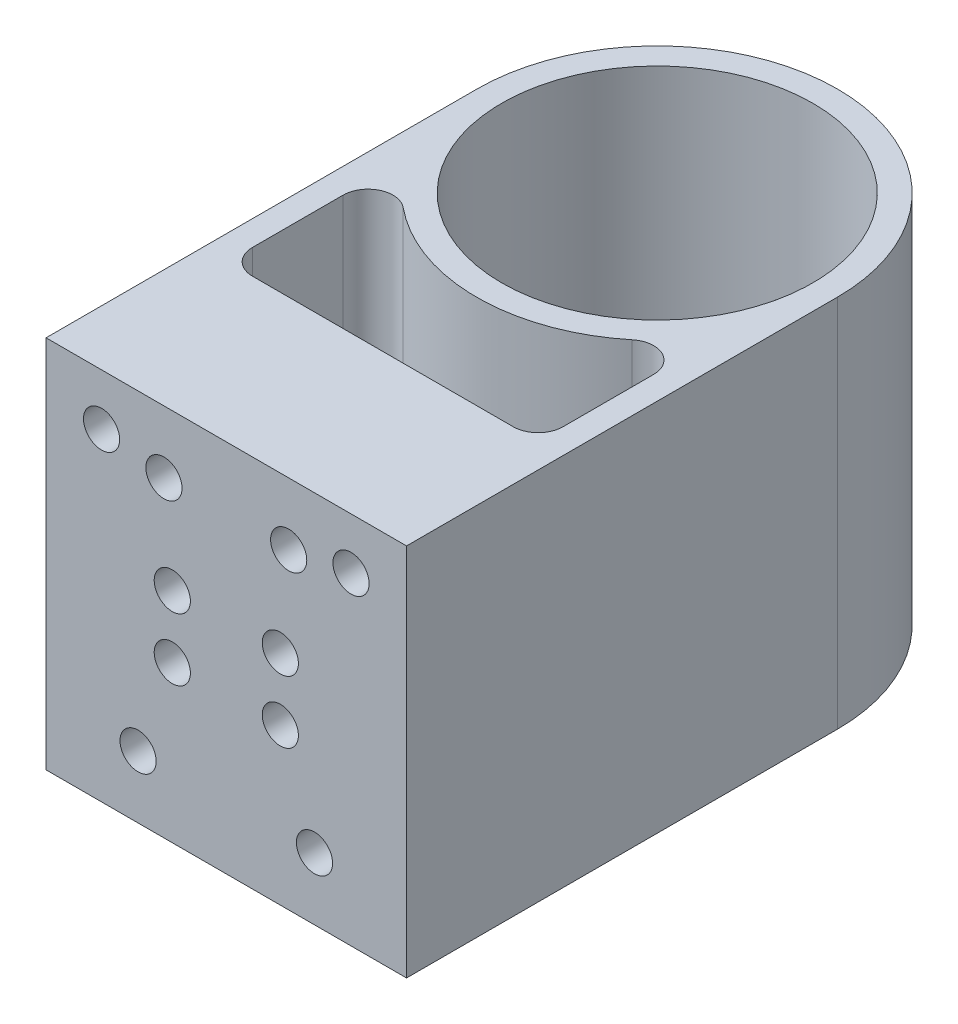
from build123d import *

# Parameters (mm, degrees)
CROQUIS1_R              = 14.45
SALIENTE_EXTRUIR1_DEPTH = 30
CROQUIS3_W              = 28.9
CROQUIS3_H              = 18.45
SALIENTE_EXTRUIR2_DEPTH = 30
CROQUIS4_R              = 12.475
CORTAR_EXTRUIR2_DEPTH   = 28
CROQUIS6_R              = 1.5
CORTAR_EXTRUIR4_DEPTH   = 28
CROQUIS7_R              = 1.45
CORTAR_EXTRUIR5_DEPTH   = 3
CROQUIS8_R              = 3.65
CORTAR_EXTRUIR6_DEPTH   = 2
SALIENTE_EXTRUIR4_START = 16.1
CROQUIS9_W              = 28.9
CROQUIS9_H              = 30
CROQUIS9_R              = 1.45
SALIENTE_EXTRUIR4_DEPTH = 16.1
CORTAR_EXTRUIR7_DEPTH   = 48.984424556


with BuildPart() as part:
    # Croquis1 → Saliente-Extruir1 (new body)
    with BuildSketch(Plane(origin=(0, 0, 0), x_dir=(1, 0, 0), z_dir=(0, 1, 0))):
        Circle(CROQUIS1_R)
    extrude(amount=SALIENTE_EXTRUIR1_DEPTH)

    # Croquis3 → Saliente-Extruir2 (add)
    with BuildSketch(Plane(origin=(0, 0, 0), x_dir=(1, 0, 0), z_dir=(0, 1, 0))):
        with Locations((0, -9.225)):
            Rectangle(CROQUIS3_W, CROQUIS3_H)
    extrude(amount=SALIENTE_EXTRUIR2_DEPTH)

    # Croquis4 → Cortar-Extruir2 (cut)
    with BuildSketch(Plane(origin=(0, 30, 0), x_dir=(1, 0, 0), z_dir=(0, 1, 0))):
        Circle(CROQUIS4_R)
    extrude(amount=-CORTAR_EXTRUIR2_DEPTH, mode=Mode.SUBTRACT)

    # Croquis6 → Cortar-Extruir4 (cut)
    with BuildSketch(Plane(origin=(0, 2, 0), x_dir=(1, 0, 0), z_dir=(0, 1, 0))):
        with Locations((8.65, 0)):
            Circle(CROQUIS6_R)
        with Locations((-8.65, 0)):
            Circle(CROQUIS6_R)
    extrude(amount=-CORTAR_EXTRUIR4_DEPTH, mode=Mode.SUBTRACT)

    # Croquis7 → Cortar-Extruir5 (cut)
    with BuildSketch(Plane.XY.offset(18.45)):
        with Locations((-5, 25)):
            Circle(CROQUIS7_R)
        with Locations((5, 25)):
            Circle(CROQUIS7_R)
        with Locations((-7.0711, 5)):
            Circle(CROQUIS7_R)
        with Locations((7.0711, 5)):
            Circle(CROQUIS7_R)
        with Locations((-4.330127019, 17.5)):
            Circle(CROQUIS7_R)
        with Locations((4.330127019, 12.5)):
            Circle(CROQUIS7_R)
        with Locations((-10, 25.88)):
            Circle(CROQUIS7_R)
        with Locations((10, 25.88)):
            Circle(CROQUIS7_R)
        with Locations((-4.330127019, 12.5)):
            Circle(CROQUIS7_R)
        with Locations((4.330127019, 17.5)):
            Circle(CROQUIS7_R)
    extrude(amount=-CORTAR_EXTRUIR5_DEPTH, mode=Mode.SUBTRACT)

    # Croquis8 → Cortar-Extruir6 (cut)
    with BuildSketch(Plane.XZ):
        Circle(CROQUIS8_R)
    extrude(amount=-CORTAR_EXTRUIR6_DEPTH, mode=Mode.SUBTRACT)

    # Croquis9 → Saliente-Extruir4 (add)
    with BuildSketch(Plane.XY.offset(18.45).offset(SALIENTE_EXTRUIR4_START)):
        with Locations((0, 15)):
            Rectangle(CROQUIS9_W, CROQUIS9_H)
        with Locations((-4.330127019, 12.5)):
            Circle(CROQUIS9_R, mode=Mode.SUBTRACT)
        with Locations((4.330127019, 17.5)):
            Circle(CROQUIS9_R, mode=Mode.SUBTRACT)
        with Locations((-5, 25)):
            Circle(CROQUIS9_R, mode=Mode.SUBTRACT)
        with Locations((5, 25)):
            Circle(CROQUIS9_R, mode=Mode.SUBTRACT)
        with Locations((-7.0711, 5)):
            Circle(CROQUIS9_R, mode=Mode.SUBTRACT)
        with Locations((7.0711, 5)):
            Circle(CROQUIS9_R, mode=Mode.SUBTRACT)
        with Locations((-4.330127019, 17.5)):
            Circle(CROQUIS9_R, mode=Mode.SUBTRACT)
        with Locations((4.330127019, 12.5)):
            Circle(CROQUIS9_R, mode=Mode.SUBTRACT)
        with Locations((-10, 25.88)):
            Circle(CROQUIS9_R, mode=Mode.SUBTRACT)
        with Locations((10, 25.88)):
            Circle(CROQUIS9_R, mode=Mode.SUBTRACT)
    extrude(amount=-SALIENTE_EXTRUIR4_DEPTH)

    # Croquis10 → Cortar-Extruir7 (cut, through all)
    with BuildSketch(Plane(origin=(0, 30, 0), x_dir=(1, 0, 0), z_dir=(0, 1, 0))):
        with BuildLine():
            Line((-10.45, -22), (10.45, -22))
            ThreePointArc((10.45, -22), (11.864213562, -21.414213562), (12.45, -20))
            Line((12.45, -20), (12.45, -12.736684223))
            ThreePointArc((12.45, -12.736684223), (11.305225835, -10.928760339), (9.181411229, -11.190501009))
            ThreePointArc((9.181411229, -11.190501009), (0, -14.475), (-9.181411229, -11.190501009))
            ThreePointArc((-9.181411229, -11.190501009), (-11.305225835, -10.928760339), (-12.45, -12.736684223))
            Line((-12.45, -12.736684223), (-12.45, -20))
            ThreePointArc((-12.45, -20), (-11.864213562, -21.414213562), (-10.45, -22))
        make_face()
    extrude(amount=-CORTAR_EXTRUIR7_DEPTH, mode=Mode.SUBTRACT)


solid = part.part
